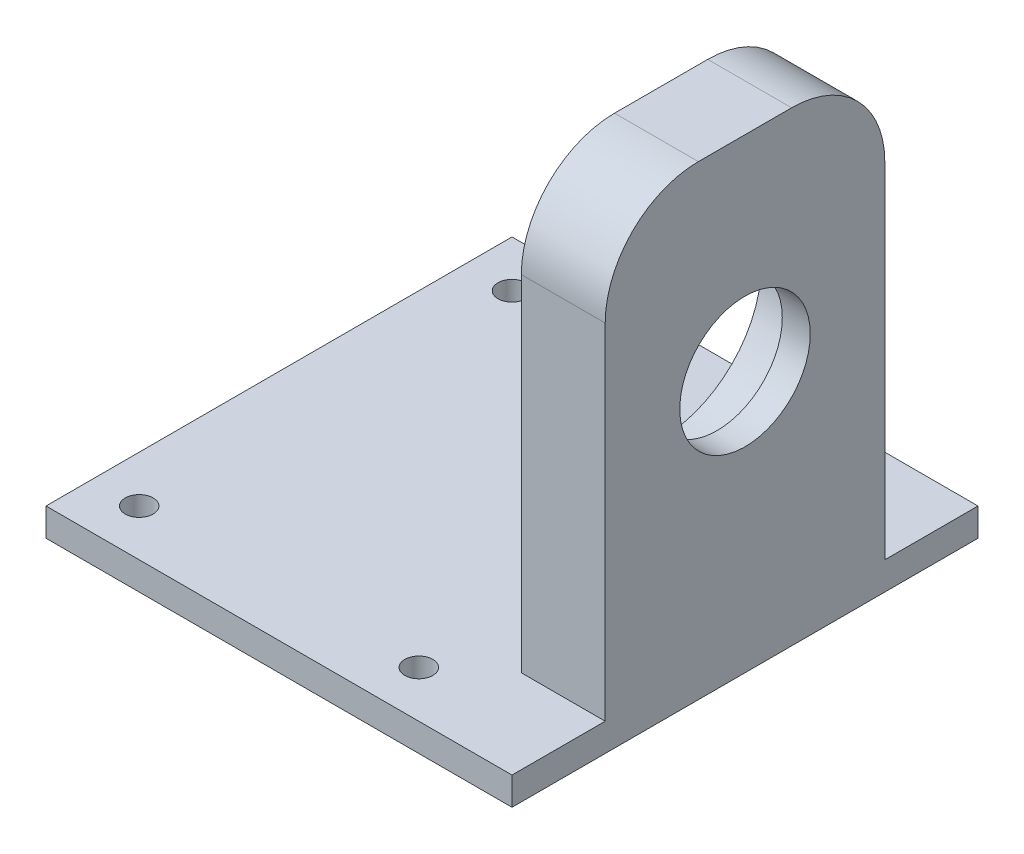
from build123d import *

# Parameters (mm, degrees)
ESQUISSE1_W             = 50
ESQUISSE1_H             = 50
BOSS_EXTRU_1_DEPTH      = 3
ESQUISSE2_W             = 9
ESQUISSE2_H             = 30
BOSS_EXTRU_2_DEPTH      = 47
ESQUISSE3_R             = 7
ENL_V_MAT_EXTRU_2_DEPTH = 3
ENL_V_MAT_EXTRU_3_REACH = 86.906
ESQUISSE4_R             = 10.75
CONG_1_R                = 10
ENL_V_MAT_EXTRU_4_REACH = 86.906
ESQUISSE5_R             = 1.5


with BuildPart() as part:
    # Esquisse1 → Boss.-Extru.1 (new body)
    with BuildSketch(Plane(origin=(0, 0, 0), x_dir=(1, 0, 0), z_dir=(0, 1, 0))):
        with Locations((25, 25)):
            Rectangle(ESQUISSE1_W, ESQUISSE1_H)
    extrude(amount=BOSS_EXTRU_1_DEPTH)

    # Esquisse2 → Boss.-Extru.2 (add)
    with BuildSketch(Plane(origin=(0, 3, 0), x_dir=(1, 0, 0), z_dir=(0, 1, 0))):
        with Locations((45.5, 25)):
            Rectangle(ESQUISSE2_W, ESQUISSE2_H)
    extrude(amount=BOSS_EXTRU_2_DEPTH)

    # Esquisse3 → Enlèv. mat.-Extru.2 (cut)
    with BuildSketch(Plane(origin=(50, 0, 0), x_dir=(0, 0, -1), z_dir=(1, 0, 0))):
        with Locations((25, 28)):
            Circle(ESQUISSE3_R)
    extrude(amount=-ENL_V_MAT_EXTRU_2_DEPTH, mode=Mode.SUBTRACT)

    # Esquisse4 → Enlèv. mat.-Extru.3 (cut, up to next)
    with BuildSketch(Plane(origin=(47, 0, 0), x_dir=(0, 0, -1), z_dir=(1, 0, 0)), mode=Mode.PRIVATE) as enl_v_mat_extru_3_sk1:
        with Locations((25, 28)):
            Circle(ESQUISSE4_R)
    enl_v_mat_extru_3_tool1 = extrude(enl_v_mat_extru_3_sk1.sketch, amount=-ENL_V_MAT_EXTRU_3_REACH, mode=Mode.PRIVATE) & part.part
    add(enl_v_mat_extru_3_tool1.solids().sort_by_distance((47, 28, -25))[0], mode=Mode.SUBTRACT)

    # Congé1
    cong_1_edges = [part.edges().sort_by_distance(p)[0] for p in [
        (45.5, 50, -40),
        (45.5, 50, -10),
    ]]
    fillet(cong_1_edges, radius=CONG_1_R)

    # Esquisse5 → Enlèv. mat.-Extru.4 (cut, up to next)
    with BuildSketch(Plane(origin=(0, 3, 0), x_dir=(1, 0, 0), z_dir=(0, 1, 0)), mode=Mode.PRIVATE) as enl_v_mat_extru_4_sk1:
        with Locations(Location((35, 45, 0), (0, 0, 270))):
            Circle(ESQUISSE5_R)
    enl_v_mat_extru_4_tool1 = extrude(enl_v_mat_extru_4_sk1.sketch, amount=-ENL_V_MAT_EXTRU_4_REACH, mode=Mode.PRIVATE) & part.part
    # Esquisse5 → Enlèv. mat.-Extru.4 (cut, up to next)
    with BuildSketch(Plane(origin=(0, 3, 0), x_dir=(1, 0, 0), z_dir=(0, 1, 0)), mode=Mode.PRIVATE) as enl_v_mat_extru_4_sk2:
        with Locations(Location((5, 45, 0), (0, 0, 270))):
            Circle(ESQUISSE5_R)
    enl_v_mat_extru_4_tool2 = extrude(enl_v_mat_extru_4_sk2.sketch, amount=-ENL_V_MAT_EXTRU_4_REACH, mode=Mode.PRIVATE) & part.part
    # Esquisse5 → Enlèv. mat.-Extru.4 (cut, up to next)
    with BuildSketch(Plane(origin=(0, 3, 0), x_dir=(1, 0, 0), z_dir=(0, 1, 0)), mode=Mode.PRIVATE) as enl_v_mat_extru_4_sk3:
        with Locations(Location((5, 5, 0), (0, 0, 270))):
            Circle(ESQUISSE5_R)
    enl_v_mat_extru_4_tool3 = extrude(enl_v_mat_extru_4_sk3.sketch, amount=-ENL_V_MAT_EXTRU_4_REACH, mode=Mode.PRIVATE) & part.part
    # Esquisse5 → Enlèv. mat.-Extru.4 (cut, up to next)
    with BuildSketch(Plane(origin=(0, 3, 0), x_dir=(1, 0, 0), z_dir=(0, 1, 0)), mode=Mode.PRIVATE) as enl_v_mat_extru_4_sk4:
        with Locations(Location((35, 5, 0), (0, 0, 270))):
            Circle(ESQUISSE5_R)
    enl_v_mat_extru_4_tool4 = extrude(enl_v_mat_extru_4_sk4.sketch, amount=-ENL_V_MAT_EXTRU_4_REACH, mode=Mode.PRIVATE) & part.part
    add(enl_v_mat_extru_4_tool1.solids().sort_by_distance((35, 3, -45))[0], mode=Mode.SUBTRACT)
    add(enl_v_mat_extru_4_tool2.solids().sort_by_distance((5, 3, -45))[0], mode=Mode.SUBTRACT)
    add(enl_v_mat_extru_4_tool3.solids().sort_by_distance((5, 3, -5))[0], mode=Mode.SUBTRACT)
    add(enl_v_mat_extru_4_tool4.solids().sort_by_distance((35, 3, -5))[0], mode=Mode.SUBTRACT)


solid = part.part
